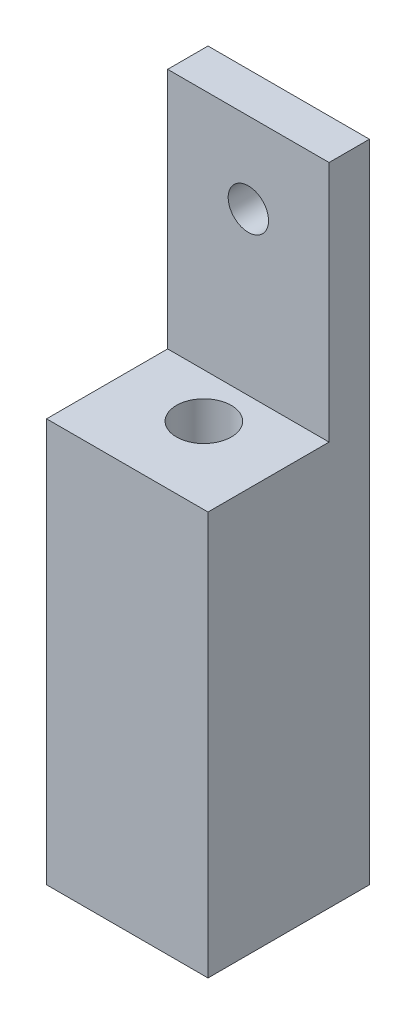
from build123d import *

# Parameters (mm, degrees)
SKETCH1_W           = 20
SKETCH1_H           = 20
SKETCH1_R           = 3.4
BOSS_EXTRUDE1_DEPTH = 25
SKETCH2_W           = 20
SKETCH2_H           = 5
BOSS_EXTRUDE2_DEPTH = 30
SKETCH3_R           = 2.5
CUT_EXTRUDE1_DEPTH  = 58.879184514


with BuildPart() as part:
    # Sketch1 → Boss-Extrude1 (new, symmetric)
    with BuildSketch(Plane(origin=(0, 0, 0), x_dir=(1, 0, 0), z_dir=(0, 1, 0))):
        Rectangle(SKETCH1_W, SKETCH1_H)
        with Locations(Location((0, -0.51, 0), (0, 0, 270))):
            Circle(SKETCH1_R, mode=Mode.SUBTRACT)
    extrude(amount=BOSS_EXTRUDE1_DEPTH, both=True)

    # Sketch2 → Boss-Extrude2 (add)
    with BuildSketch(Plane(origin=(0, 25, 0), x_dir=(1, 0, 0), z_dir=(0, 1, 0))):
        with Locations((0, 7.5)):
            Rectangle(SKETCH2_W, SKETCH2_H)
    extrude(amount=BOSS_EXTRUDE2_DEPTH)

    # Sketch3 → Cut-Extrude1 (cut, through all)
    with BuildSketch(Plane.XY.offset(-5)):
        with Locations((0, 45)):
            Circle(SKETCH3_R)
    extrude(amount=-CUT_EXTRUDE1_DEPTH, mode=Mode.SUBTRACT)


solid = part.part
